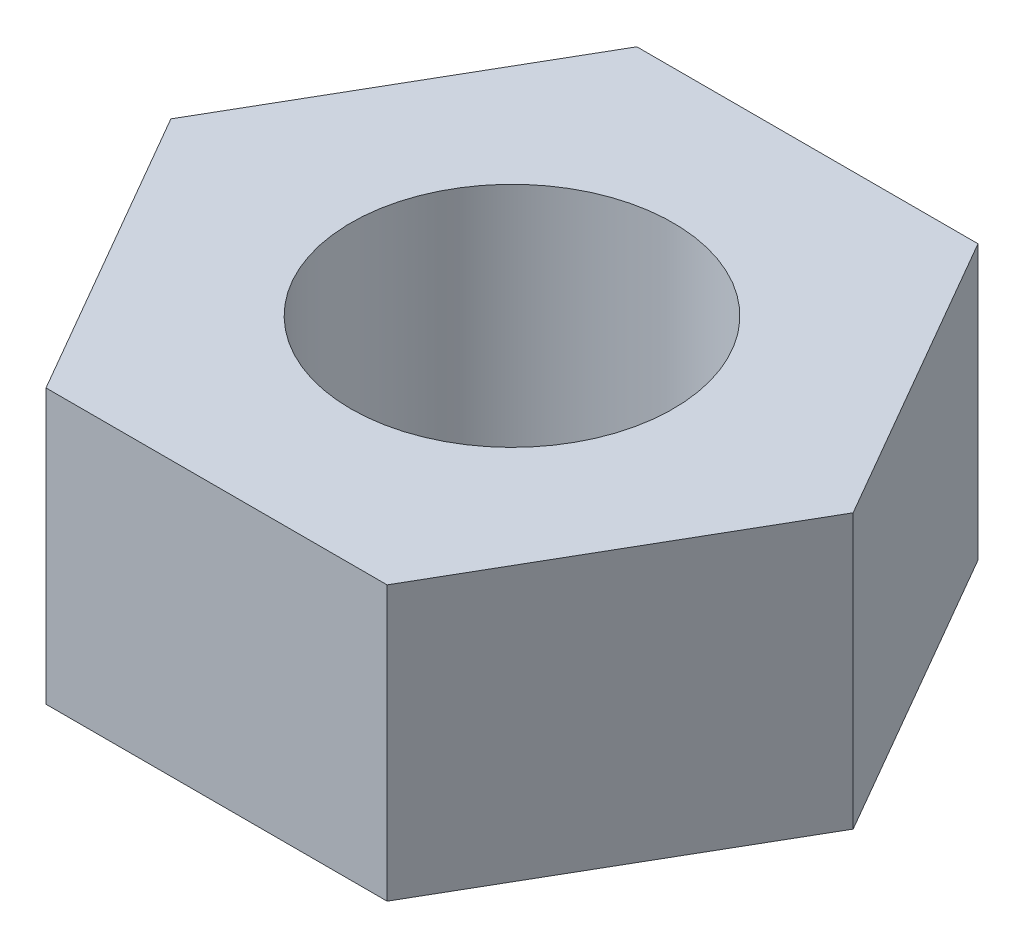
from build123d import *

# Parameters (mm, degrees)
SKETCH1_R           = 1.5
BOSS_EXTRUDE1_DEPTH = 2.55


with BuildPart() as part:
    # Sketch1 → Boss-Extrude1 (new body)
    with BuildSketch(Plane(origin=(0, 0, 0), x_dir=(1, 0, 0), z_dir=(0, 1, 0))):
        Polygon((3.175426481, 0), (1.58771324, 2.75), (-1.58771324, 2.75), (-3.175426481, 0), (-1.58771324, -2.75), (1.58771324, -2.75), align=None)
        with Locations(Location((0, 0, 0), (0, 0, 270))):
            Circle(SKETCH1_R, mode=Mode.SUBTRACT)
    extrude(amount=BOSS_EXTRUDE1_DEPTH)


solid = part.part
